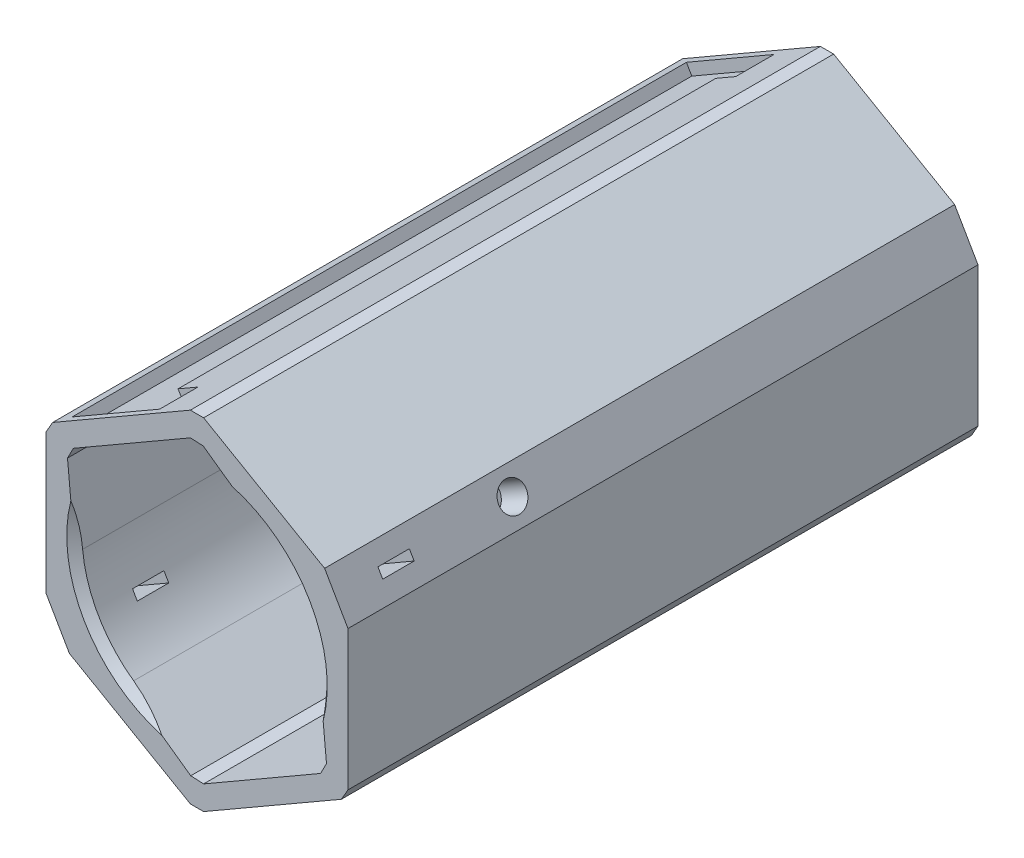
from build123d import *

# Parameters (mm, degrees)
SKETCH2_R               = 16
BOSS_EXTRUDE1_DEPTH     = 82.25
CUT_EXTRUDE1_DEPTH      = 97.457244414
CUT_EXTRUDE1_DEPTH_BACK = 97.457244414
SKETCH3_W               = 152.01959988
SKETCH3_H               = 124.433031562
CUT_EXTRUDE2_DEPTH      = 1.4
CHAMFER2_SIZE           = 1
CHAMFER3_SIZE           = 1
CUT_EXTRUDE3_DEPTH      = 71
CHAMFER4_SIZE           = 1
CUT_EXTRUDE4_DEPTH      = 1.2
SKETCH8_R               = 2.75
CUT_EXTRUDE5_DEPTH      = 87.332400234
CUT_EXTRUDE7_DEPTH      = 5
CHAMFER5_SIZE           = 0.5
CUT_EXTRUDE8_DEPTH      = 88.459952722
SKETCH12_R              = 1.8
CUT_EXTRUDE9_DEPTH      = 4
CUT_EXTRUDE10_START     = -4
SKETCH13_R              = 1.8
CUT_EXTRUDE10_DEPTH     = 4
SKETCH14_W              = 4.1
SKETCH14_H              = 1.25
CUT_EXTRUDE11_DEPTH     = 87.894692785


with BuildPart() as part:
    # Sketch1 → Revolve1 (revolve)
    with BuildSketch(Plane(origin=(0, 0, 0), x_dir=(1, 0, 0), z_dir=(0, 1, 0))):
        Polygon((0, 0), (16.125, 0), (16.125, -71), (19.65, -71), (19.65, 68), (24.95, 68), (24.95, 73), (28.1, 73), (28.1, 68), (42, 68), (42, 76), (16.65, 76), (16.65, 18.004366875), (12.193967069, 18.004366875), (12.193967069, 24.882682167), (0, 24.882682167), align=None)
    revolve(axis=Axis((0, 0, 39.840023079), (0, 0, -1)))

    # Sketch2 → Boss-Extrude1 (add)
    with BuildSketch(Plane.XY.offset(71)):
        Polygon((0, 22.762034363), (-19.7125, 11.381017181), (-19.7125, -11.381017181), (0, -22.762034363), (19.7125, -11.381017181), (19.7125, 11.381017181), align=None)
        Circle(SKETCH2_R, mode=Mode.SUBTRACT)
    extrude(amount=-BOSS_EXTRUDE1_DEPTH)

    # Sketch3 → Cut-Extrude1 (cut, two sides: drawn at the far end of the back side and taken through both)
    with BuildSketch(Plane(origin=(0, 0, 0), x_dir=(1, 0, 0), z_dir=(0, 1, 0)).offset(-CUT_EXTRUDE1_DEPTH_BACK)):
        with Locations((6.162956752, 73.466515781)):
            Rectangle(SKETCH3_W, SKETCH3_H)
    extrude(amount=CUT_EXTRUDE1_DEPTH + CUT_EXTRUDE1_DEPTH_BACK, mode=Mode.SUBTRACT)

    # Sketch4 → Cut-Extrude2 (cut)
    with BuildSketch(Plane(origin=(-9.85625, 17.071525772, 0), x_dir=(0.8660254037844386, 0.5000000000000003, 0), z_dir=(-0.5000000000000002, 0.8660254037844385, 0))):
        Polygon((-8.6, 10.2), (4.6, 10.2), (4.6, 5.2), (1.6, 5.2), (1.6, -65), (4.6, -65), (4.6, -70), (-8.6, -70), align=None)
    extrude(amount=-CUT_EXTRUDE2_DEPTH, mode=Mode.SUBTRACT)

    # Chamfer2
    chamfer2_edges = [part.edges().sort_by_distance(p)[0] for p in [
        (0, 22.762034363, 29.875),
        (19.7125, 11.381017181, 29.875),
        (19.7125, -11.381017181, 29.875),
        (0, -22.762034363, 29.875),
        (-19.7125, -11.381017181, 29.875),
        (-19.7125, 11.381017181, 29.875),
    ]]
    chamfer(chamfer2_edges, length=CHAMFER2_SIZE)

    # Chamfer3
    chamfer3_edges = [part.edges().sort_by_distance(p)[0] for p in [
        (-16, 0, 71),
    ]]
    chamfer(chamfer3_edges, length=CHAMFER3_SIZE)

    # Sketch5 → Cut-Extrude3 (cut)
    with BuildSketch(Plane.XY.offset(71)):
        with BuildLine():
            Line((-17, 9.814954576), (-15.92887426, -1.50697207))
            ThreePointArc((-15.92887426, -1.50697207), (-8, 13.85640646), (9.269513225, 13.041323728))
            Line((9.269513225, 13.041323728), (0, 19.629909152))
            Line((0, 19.629909152), (-17, 9.814954576))
        make_face()
        with BuildLine():
            Line((0, -19.629909152), (17, -9.814954576))
            Line((17, -9.814954576), (15.92887426, 1.50697207))
            ThreePointArc((15.92887426, 1.50697207), (8, -13.856406461), (-9.269513225, -13.041323728))
            Line((-9.269513225, -13.041323728), (0, -19.629909152))
        make_face()
    extrude(amount=-CUT_EXTRUDE3_DEPTH, mode=Mode.SUBTRACT)

    # Chamfer4
    chamfer4_edges = [part.edges().sort_by_distance(p)[0] for p in [
        (0, -19.629909152, 35.5),
        (17, -9.814954576, 35.5),
        (0, 19.629909152, 35.5),
        (-17, 9.814954576, 35.5),
    ]]
    chamfer(chamfer4_edges, length=CHAMFER4_SIZE)

    # Sketch6 → Cut-Extrude4 (cut)
    with BuildSketch(Plane(origin=(0, 0, -11.25), x_dir=(-1, 0, 0), z_dir=(0, 0, -1))):
        Polygon((-7.216878365, 12.5), (-14.43375673, 0), (-7.216878365, -12.5), (7.216878365, -12.5), (14.43375673, 0), (7.216878365, 12.5), align=None)
    extrude(amount=-CUT_EXTRUDE4_DEPTH, mode=Mode.SUBTRACT)

    # Sketch8 → Cut-Extrude5 (cut, through all)
    with BuildSketch(Plane(origin=(0, 0, -10.05), x_dir=(-1, 0, 0), z_dir=(0, 0, -1))):
        Circle(SKETCH8_R)
    extrude(amount=-CUT_EXTRUDE5_DEPTH, mode=Mode.SUBTRACT)

    # Sketch10 → Cut-Extrude7 (cut)
    with BuildSketch(Plane.XY):
        with BuildLine():
            Line((2.5, 10), (-2.5, 10))
            Line((-2.5, 10), (-2.5, 7.071067812))
            ThreePointArc((-2.5, 7.071067812), (0, -7.5), (2.5, 7.071067812))
            Line((2.5, 7.071067812), (2.5, 10))
        make_face()
    extrude(amount=-CUT_EXTRUDE7_DEPTH, mode=Mode.SUBTRACT)

    # Chamfer5
    chamfer5_edges = [part.edges().sort_by_distance(p)[0] for p in [
        (0, -7.5, 0),
        (2.5, 8.535533906, 0),
        (0, 10, 0),
        (-2.5, 8.535533906, 0),
    ]]
    chamfer(chamfer5_edges, length=CHAMFER5_SIZE)

    # Sketch11 → Cut-Extrude8 (cut, through all)
    with BuildSketch(Plane.XY.offset(71)):
        Polygon((19.7125, 11.381017181), (16.660566959, 13.143051544), (19.7125, 7.856948456), align=None)
        Polygon((-16.660566959, -13.143051544), (-19.7125, -11.381017181), (-19.7125, -7.856948456), align=None)
    extrude(amount=-CUT_EXTRUDE8_DEPTH, mode=Mode.SUBTRACT)

    # Sketch12 → Cut-Extrude9 (cut)
    with BuildSketch(Plane(origin=(-18.186533479, -10.5, 0), x_dir=(0, 0, 1), z_dir=(-0.8660254037844382, -0.500000000000001, 0))):
        with Locations(Location((48, 0, 0), (0, 0, 270))):
            Circle(SKETCH12_R)
    extrude(amount=-CUT_EXTRUDE9_DEPTH, mode=Mode.SUBTRACT)

    # Sketch13 → Cut-Extrude10 (cut)
    with BuildSketch(Plane(origin=(18.186533479, 10.5, 0), x_dir=(0, 0, -1), z_dir=(0.8660254037844387, 0.4999999999999999, 0)).offset(CUT_EXTRUDE10_START)):
        with Locations(Location((-48, 0, 0), (0, 0, 270))):
            Circle(SKETCH13_R)
    extrude(amount=CUT_EXTRUDE10_DEPTH, mode=Mode.SUBTRACT)

    # Sketch14 → Cut-Extrude11 (cut, through all)
    with BuildSketch(Plane(origin=(18.186533479, 10.5, 0), x_dir=(0, 0, -1), z_dir=(0.8660254037844387, 0.4999999999999999, 0))):
        with Locations((-63.2, 0)):
            Rectangle(SKETCH14_W, SKETCH14_H)
    extrude(amount=-CUT_EXTRUDE11_DEPTH, mode=Mode.SUBTRACT)


solid = part.part
